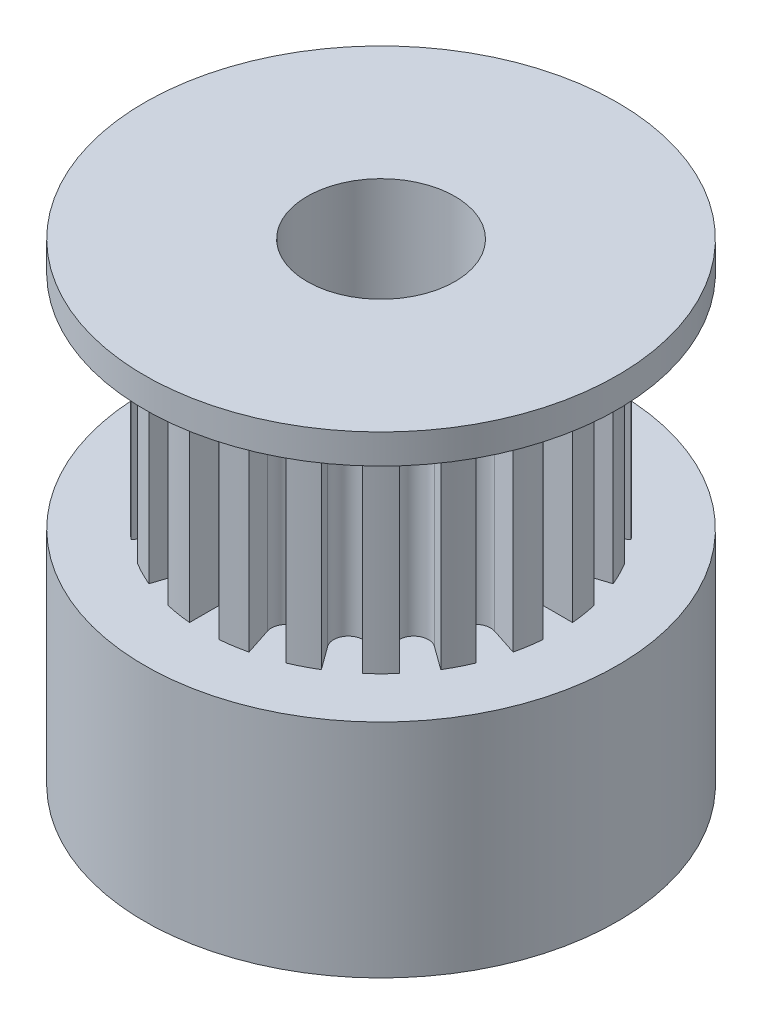
from build123d import *

# Parameters (mm, degrees)
SKETCH_2_R               = 0.5
SKETCH_2_W               = 1
SKETCH_2_H               = 4
CUT_EXTRUDE_1_DEPTH      = 7.5
PATTERN_CIRCULAR_1_COUNT = 20
SKETCH_3_R               = 2.5
CUT_EXTRUDE_2_DEPTH      = 20.595917942


with BuildPart() as part:
    # 草图1 → 旋转3 (revolve)
    with BuildSketch(Plane.XY, mode=Mode.PRIVATE) as revolve_3_sk:
        Polygon((-8, 0), (0, 0), (0, -16), (-8, -16), (-8, -8.5), (-6, -8.5), (-6, -1), (-8, -1), align=None)
    revolve(revolve_3_sk.sketch.rotate(Axis((0, 0, 0), (0, 1, 0)), 270), axis=Axis((0, 0, 0), (0, 1, 0)))

    # 草图2 → 切除-拉伸1 (cut)
    with BuildSketch(Plane.XZ.offset(1)):
        with Locations((0, 5)):
            Circle(SKETCH_2_R)
        with Locations((0, 7)):
            Rectangle(SKETCH_2_W, SKETCH_2_H)
    cut_extrude_1 = extrude(amount=CUT_EXTRUDE_1_DEPTH, mode=Mode.SUBTRACT)

    # 阵列(圆周)1: 切除-拉伸1 ×20 about axis
    pattern_circular_1_axis = Axis((0, 0, 0), (0, 1, 0))
    for i in range(1, PATTERN_CIRCULAR_1_COUNT):
        add(cut_extrude_1.rotate(pattern_circular_1_axis, i * 360 / PATTERN_CIRCULAR_1_COUNT), mode=Mode.SUBTRACT)

    # 草图3 → 切除-拉伸2 (cut, through all)
    with BuildSketch(Plane(origin=(0, 0, 0), x_dir=(1, 0, 0), z_dir=(0, 1, 0))):
        with Locations(Location((0, 0, 0), (0, 0, 270))):
            Circle(SKETCH_3_R)
    extrude(amount=-CUT_EXTRUDE_2_DEPTH, mode=Mode.SUBTRACT)


solid = part.part
